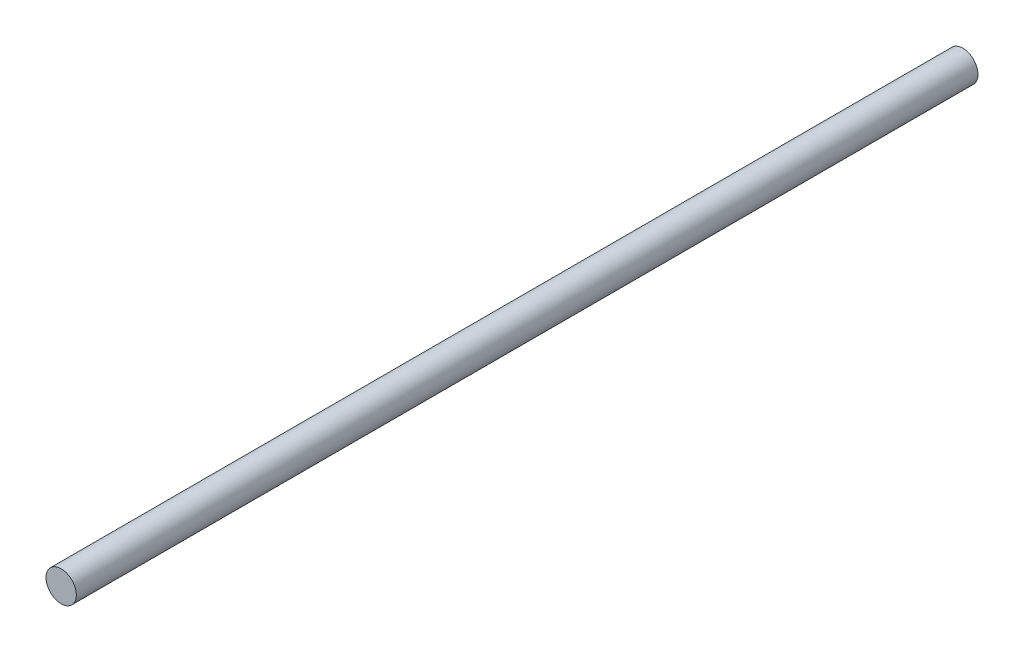
from build123d import *

# Parameters (mm, degrees)
SKETCH1_R           = 2.5
BOSS_EXTRUDE1_DEPTH = 148.5


with BuildPart() as part:
    # Sketch1 → Boss-Extrude1 (new body)
    with BuildSketch(Plane.XY):
        Circle(SKETCH1_R)
    extrude(amount=BOSS_EXTRUDE1_DEPTH)


solid = part.part
